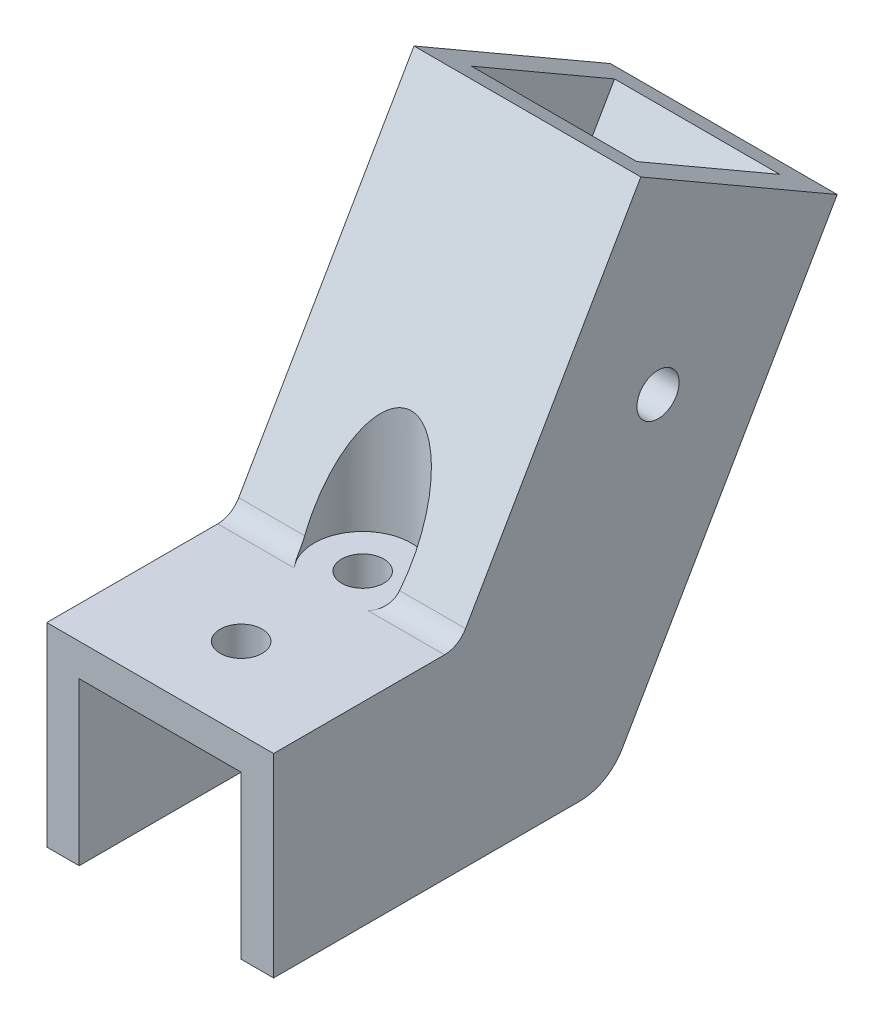
from build123d import *

# Parameters (mm, degrees)
BOSS_EXTRUDE1_DEPTH = 28
BOSS_EXTRUDE2_DEPTH = 28
SKETCH5_W           = 20.4
SKETCH5_H           = 20.4
CUT_EXTRUDE3_DEPTH  = 30
CUT_EXTRUDE4_DEPTH  = 20.4
SKETCH7_R           = 2.6
CUT_EXTRUDE5_DEPTH  = 57.903989341
SKETCH8_W           = 20
SKETCH8_H           = 20
CUT_EXTRUDE6_DEPTH  = 60.150040009
SKETCH9_W           = 4
SKETCH9_H           = 20
BOSS_EXTRUDE3_DEPTH = 20
BOSS_EXTRUDE4_DEPTH = 15
SKETCH11_R          = 2.6
CUT_EXTRUDE7_DEPTH  = 65.43228341
SKETCH12_R          = 6
CUT_EXTRUDE8_DEPTH  = 62.836477907
FILLET1_R           = 3
FILLET2_R           = 6


with BuildPart() as part:
    # Sketch1 → Boss-Extrude1 (new body)
    with BuildSketch(Plane(origin=(0, 0, 0), x_dir=(0, 0, -1), z_dir=(1, 0, 0))):
        Polygon((0, 0), (-24, 0), (-24, -4), (-4, -4), (-4, -24), (0, -24), align=None)
    extrude(amount=BOSS_EXTRUDE1_DEPTH)

    # Sketch2 → Boss-Extrude2 (add)
    with BuildSketch(Plane(origin=(28, 0, 0), x_dir=(0, 0, -1), z_dir=(1, 0, 0))):
        Polygon((2.309401077, -24), (30.582903769, 24.97114317), (6.334192463, 38.97114317), (-16.165807537, 0), (0, 0), (0, -24), align=None)
    extrude(amount=-BOSS_EXTRUDE2_DEPTH)

    # Sketch5 → Cut-Extrude3 (cut)
    with BuildSketch(Plane(origin=(0, 31.97114317, -18.458548116), x_dir=(1, 0, 0), z_dir=(0, 0.8660254037844402, -0.4999999999999977))):
        with Locations((14, 0)):
            Rectangle(SKETCH5_W, SKETCH5_H)
    extrude(amount=-CUT_EXTRUDE3_DEPTH, mode=Mode.SUBTRACT)

    # Sketch6 → Cut-Extrude4 (cut)
    with BuildSketch(Plane(origin=(3.8, 0, 0), x_dir=(0, 0, -1), z_dir=(1, 0, 0))):
        Polygon((12.292007234, 0.890381057), (3.458548116, 5.990381057), (3.458548116, -14.409618943), align=None)
    extrude(amount=CUT_EXTRUDE4_DEPTH, mode=Mode.SUBTRACT)

    # Sketch7 → Cut-Extrude5 (cut, through all)
    with BuildSketch(Plane(origin=(28, 0, 0), x_dir=(0, 0, -1), z_dir=(1, 0, 0))):
        with Locations((8.458548116, 14.650635095)):
            Circle(SKETCH7_R)
    extrude(amount=-CUT_EXTRUDE5_DEPTH, mode=Mode.SUBTRACT)

    # Sketch8 → Cut-Extrude6 (cut, through all)
    with BuildSketch(Plane.XY.offset(4)):
        with Locations((14, -14)):
            Rectangle(SKETCH8_W, SKETCH8_H)
    extrude(amount=-CUT_EXTRUDE6_DEPTH, mode=Mode.SUBTRACT)

    # Sketch9 → Boss-Extrude3 (add)
    with BuildSketch(Plane.XY.offset(4)):
        with Locations((2, -14)):
            Rectangle(SKETCH9_W, SKETCH9_H)
        with Locations((26, -14)):
            Rectangle(SKETCH9_W, SKETCH9_H)
    extrude(amount=BOSS_EXTRUDE3_DEPTH)

    # Sketch10 → Boss-Extrude4 (add)
    with BuildSketch(Plane.XY.offset(24)):
        Polygon((0, 0), (28, 0), (28, -24), (24, -24), (24, -4), (4, -4), (4, -24), (0, -24), align=None)
    extrude(amount=BOSS_EXTRUDE4_DEPTH)

    # Sketch11 → Cut-Extrude7 (cut, through all)
    with BuildSketch(Plane.XZ.offset(4)):
        with Locations(Location((14, 29, 0), (0, 0, 270))):
            Circle(SKETCH11_R)
        with Locations(Location((14, 14, 0), (0, 0, 270))):
            Circle(SKETCH11_R)
    extrude(amount=-CUT_EXTRUDE7_DEPTH, mode=Mode.SUBTRACT)

    # Sketch12 → Cut-Extrude8 (cut, through all)
    with BuildSketch(Plane(origin=(0, 0, 0), x_dir=(1, 0, 0), z_dir=(0, 1, 0))):
        with Locations((14, -14)):
            Circle(SKETCH12_R)
    extrude(amount=CUT_EXTRUDE8_DEPTH, mode=Mode.SUBTRACT)

    # Fillet1
    fillet1_edges = [part.edges().sort_by_distance(p)[0] for p in [
        (23.797734696, 0, 16.165807537),
        (4.202265304, 0, 16.165807537),
    ]]
    fillet(fillet1_edges, radius=FILLET1_R)

    # Fillet2
    fillet2_edges = [part.edges().sort_by_distance(p)[0] for p in [
        (2, -24, -2.309401077),
        (26, -24, -2.309401077),
    ]]
    fillet(fillet2_edges, radius=FILLET2_R)


solid = part.part
